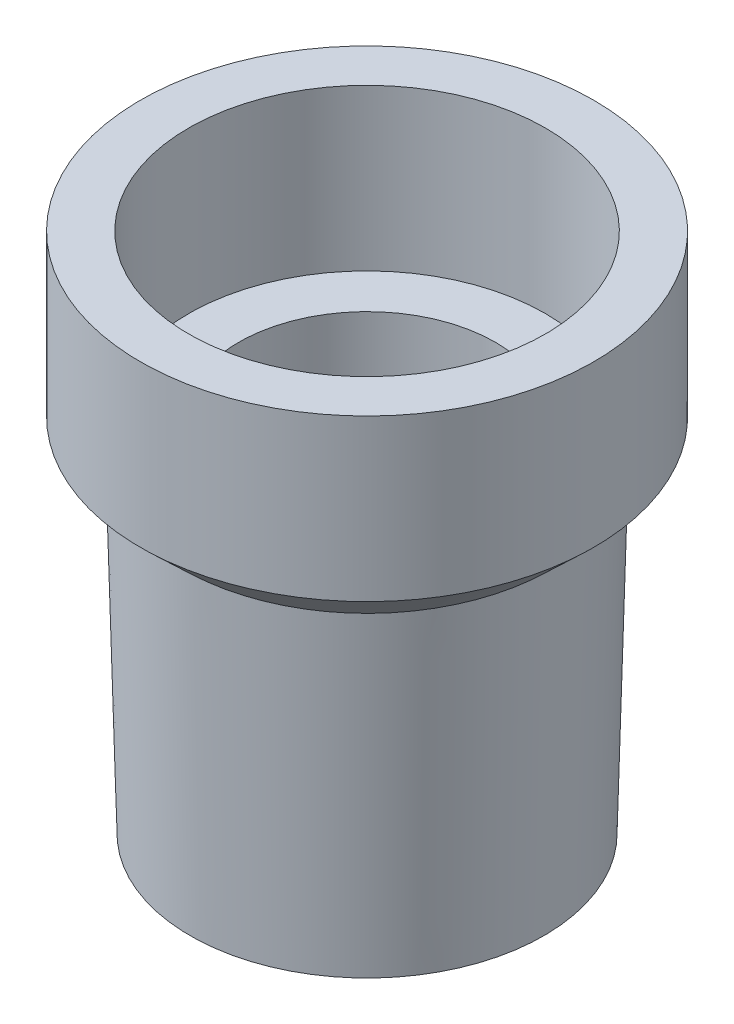
from build123d import *


with BuildPart() as part:
    # Sketch1 → Revolve1 (revolve)
    with BuildSketch(Plane.XY, mode=Mode.PRIVATE) as revolve1_sk:
        Polygon((11.1, 22.473170732), (11.1, 32.473170732), (14.1, 32.473170732), (14.1, 22.473170732), (11.5, 20), (11, 0), (8, 0), (8, 22.473170732), align=None)
    revolve(revolve1_sk.sketch.rotate(Axis((0, 0, 0), (0, 1, 0)), 90), axis=Axis((0, 0, 0), (0, 1, 0)))


solid = part.part
